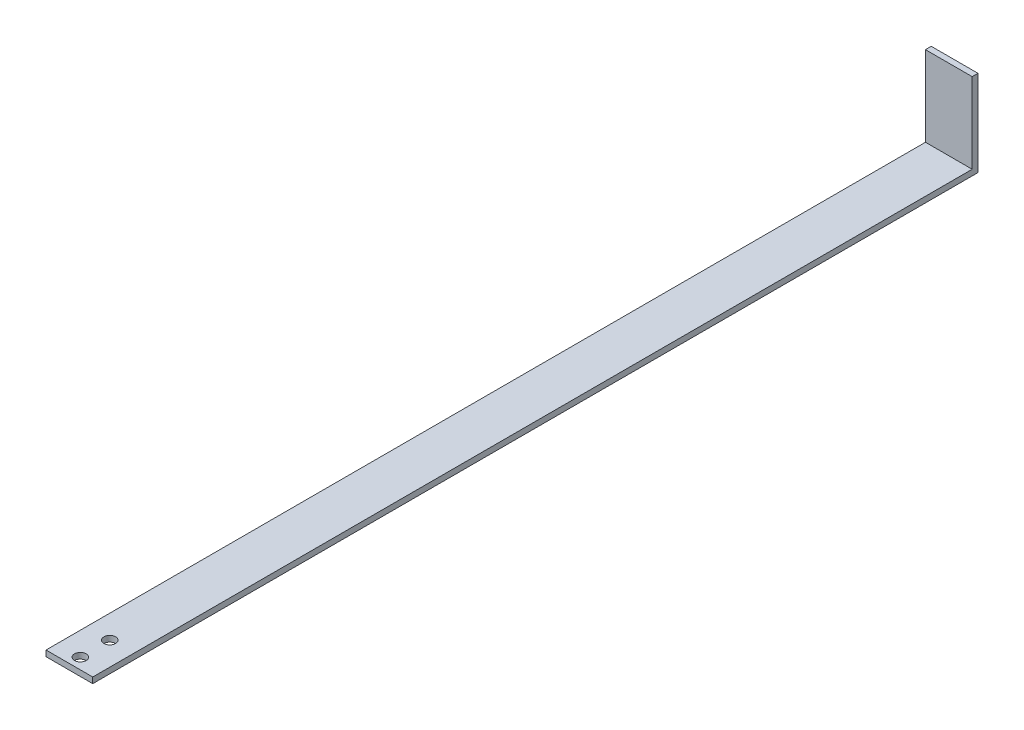
from build123d import *

# Parameters (mm, degrees)
SALIENTE_EXTRUIR1_DEPTH = 50.8
CROQUIS6_R              = 6.35
CORTAR_EXTRUIR1_DEPTH   = 10


with BuildPart() as part:
    # Croquis1 → Saliente-Extruir1 (new body)
    with BuildSketch(Plane(origin=(0, 0, 0), x_dir=(0, 0, -1), z_dir=(1, 0, 0))):
        Polygon((-6.31, 93.46), (0, 93.46), (0, 0), (-962, 0), (-962, 6.31), (-6.31, 6.31), align=None)
    extrude(amount=SALIENTE_EXTRUIR1_DEPTH)

    # Croquis6 → Cortar-Extruir1 (cut)
    with BuildSketch(Plane.XZ):
        with Locations(Location((25.4, 918.107795334, 0), (0, 0, 270))):
            Circle(CROQUIS6_R)
        with Locations(Location((25.4, 950.107795334, 0), (0, 0, 270))):
            Circle(CROQUIS6_R)
    extrude(amount=-CORTAR_EXTRUIR1_DEPTH, mode=Mode.SUBTRACT)


solid = part.part
